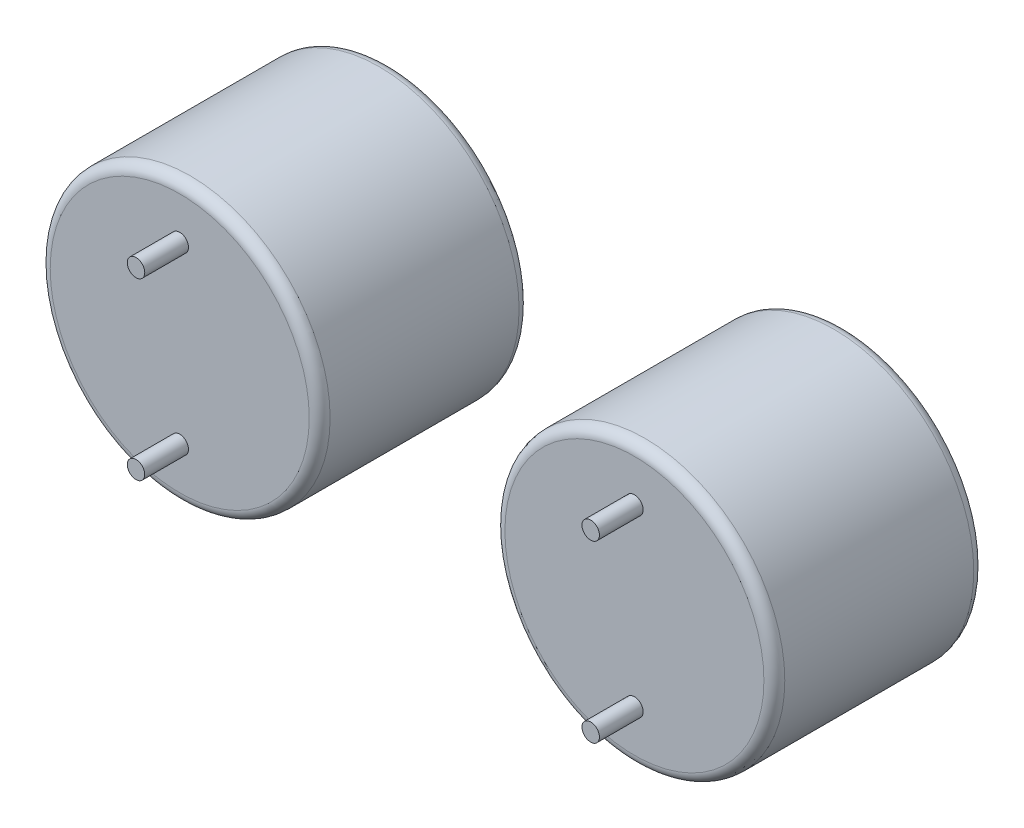
from build123d import *

# Parameters (mm, degrees)
SKETCH11_R = 0.5
PINS_DEPTH = 2.5


with BuildPart() as part:
    # Sketch5 → T (revolve)
    with BuildSketch(Plane(origin=(0, 0, 0), x_dir=(1, 0, 0), z_dir=(0, 1, 0))):
        with BuildLine():
            Line((18.242402027, 8.478430477), (14.078638826, 6))
            Line((14.078638826, 6), (13, 6))
            Line((13, 6), (13, 0))
            Line((13, 0), (20.405391121, 0))
            ThreePointArc((20.405391121, 0), (20.82617438, 0.177630662), (21, 0.6))
            Line((21, 0.6), (21, 11.405367115))
            ThreePointArc((21, 11.405367115), (20.82238625, 11.826157406), (20.400024005, 12))
            Line((20.400024005, 12), (19.5, 12))
            Line((19.5, 12), (19.5, 11.6))
            Line((19.5, 11.6), (20.2, 11.6))
            Line((20.2, 11.6), (20.2, 1))
            Line((20.2, 1), (19.392393768, 1))
            Line((19.392393768, 1), (19.392393768, 5.425004129))
            Line((19.392393768, 5.425004129), (14.316568152, 5.425004129))
            Line((14.316568152, 5.425004129), (18.242402027, 8.002571825))
            Line((18.242402027, 8.002571825), (18.242402027, 8.478430477))
        make_face()
    revolve(axis=Axis((13, 0, -12.001248523), (0, 0, 1)))



with BuildPart() as body_2:
    # Sketch5<3> → R (revolve)
    with BuildSketch(Plane(origin=(0, 0, 0), x_dir=(1, 0, 0), z_dir=(0, 1, 0))):
        with BuildLine():
            Line((-13, 0), (-13, 6))
            Line((-13, 6), (-14.078638826, 6))
            Line((-14.078638826, 6), (-18.242402027, 8.478430477))
            Line((-18.242402027, 8.478430477), (-18.242402027, 8.002571825))
            Line((-18.242402027, 8.002571825), (-14.316568152, 5.425004129))
            Line((-14.316568152, 5.425004129), (-19.392393768, 5.425004129))
            Line((-19.392393768, 5.425004129), (-19.392393768, 1))
            Line((-19.392393768, 1), (-20.2, 1))
            Line((-20.2, 1), (-20.2, 11.6))
            Line((-20.2, 11.6), (-19.5, 11.6))
            Line((-19.5, 11.6), (-19.5, 12))
            Line((-19.5, 12), (-20.400024005, 12))
            ThreePointArc((-20.400024005, 12), (-20.82238625, 11.826157406), (-21, 11.405367115))
            Line((-21, 11.405367115), (-21, 0.6))
            ThreePointArc((-21, 0.6), (-20.82617438, 0.177630662), (-20.405391121, 0))
            Line((-20.405391121, 0), (-13, 0))
        make_face()
    revolve(axis=Axis((-13, 0, -11.196108303), (0, 0, 1)))


with BuildPart() as part_1:
    add(part.part)

    add(body_2.part)  # Pins merges body 2
    # Sketch11 → Pins (add)
    with BuildSketch(Plane.XY):
        with Locations((-13, 5)):
            Circle(SKETCH11_R)
        with Locations((-13, -5)):
            Circle(SKETCH11_R)
        with Locations((13, 5)):
            Circle(SKETCH11_R)
        with Locations((13, -5)):
            Circle(SKETCH11_R)
    extrude(amount=PINS_DEPTH)


solid = part_1.part
